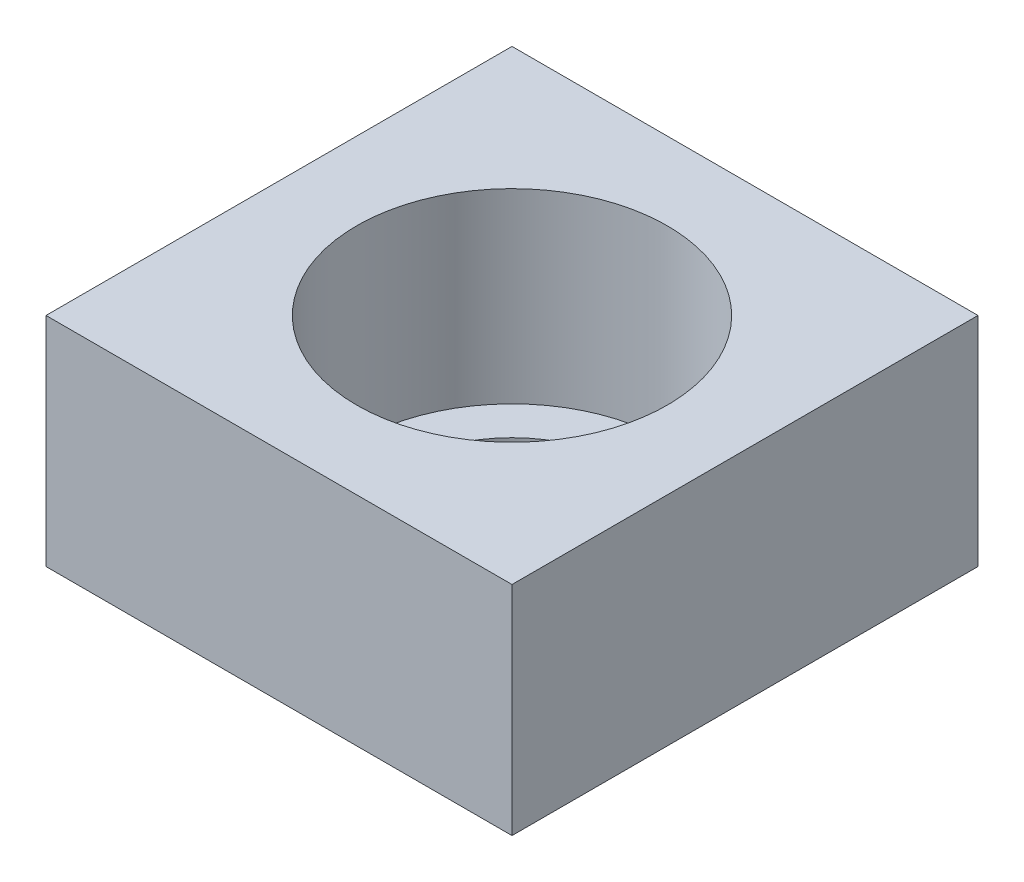
from build123d import *

# Parameters (mm, degrees)
SKETCH2_W           = 45
SKETCH2_H           = 45
SKETCH2_R           = 11
BOSS_EXTRUDE1_DEPTH = 21
SKETCH3_R           = 15
CUT_EXTRUDE1_DEPTH  = 18


with BuildPart() as part:
    # Sketch2 → Boss-Extrude1 (new body)
    with BuildSketch(Plane(origin=(0, 0, 0), x_dir=(1, 0, 0), z_dir=(0, 1, 0))):
        Rectangle(SKETCH2_W, SKETCH2_H)
        with Locations(Location((0, 0, 0), (0, 0, 90))):
            Circle(SKETCH2_R, mode=Mode.SUBTRACT)
    extrude(amount=BOSS_EXTRUDE1_DEPTH)

    # Sketch3 → Cut-Extrude1 (cut)
    with BuildSketch(Plane(origin=(0, 21, 0), x_dir=(1, 0, 0), z_dir=(0, 1, 0))):
        with Locations(Location((0, 0, 0), (0, 0, 270))):
            Circle(SKETCH3_R)
    extrude(amount=-CUT_EXTRUDE1_DEPTH, mode=Mode.SUBTRACT)


solid = part.part
